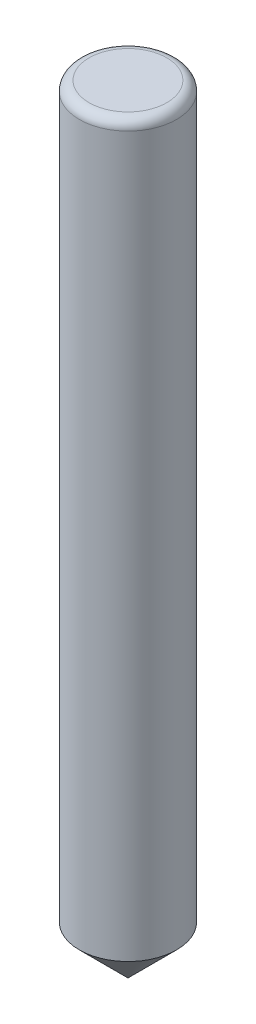
from build123d import *

# Parameters (mm, degrees)
SKETCH1_R           = 5
BOSS_EXTRUDE1_DEPTH = 80
CHAMFER1_SIZE       = 5
FILLET1_R           = 1


with BuildPart() as part:
    # Sketch1 → Boss-Extrude1 (new body)
    with BuildSketch(Plane(origin=(0, 0, 0), x_dir=(1, 0, 0), z_dir=(0, 1, 0))):
        with Locations(Location((0, 0, 0), (0, 0, 270))):
            Circle(SKETCH1_R)
    extrude(amount=BOSS_EXTRUDE1_DEPTH)

    # Chamfer1
    chamfer1_edges = [part.edges().sort_by_distance(p)[0] for p in [
        (0, 0, -5),
    ]]
    chamfer(chamfer1_edges, length=CHAMFER1_SIZE)

    # Fillet1
    fillet1_edges = [part.edges().sort_by_distance(p)[0] for p in [
        (0, 80, -5),
    ]]
    fillet(fillet1_edges, radius=FILLET1_R)


solid = part.part
